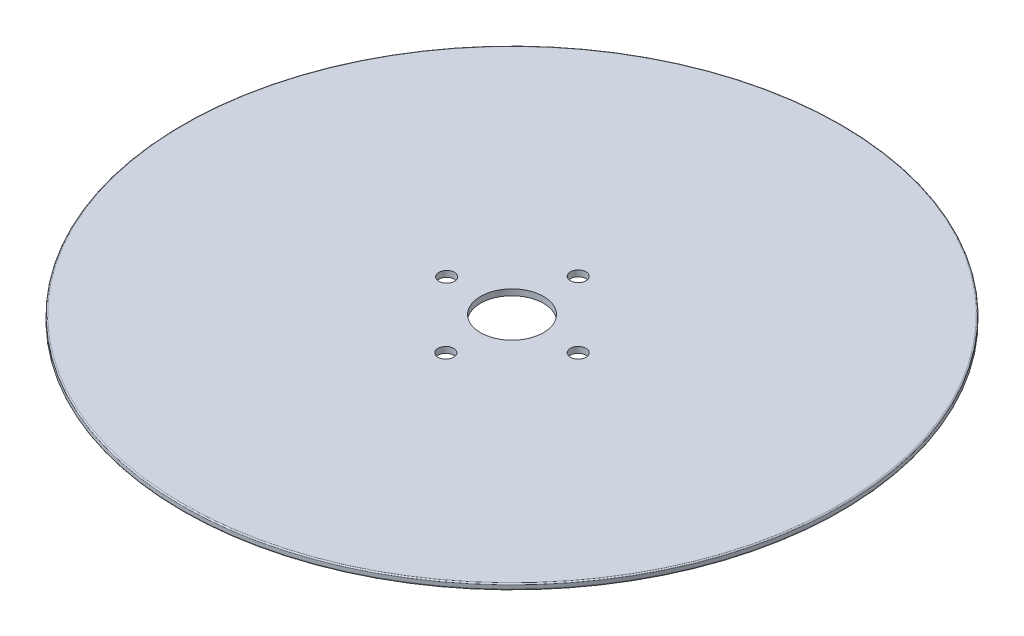
from build123d import *

# Parameters (mm, degrees)
SKETCH1_R           = 55
BOSS_EXTRUDE1_DEPTH = 1
FILLET2_R           = 0.2
SKETCH4_R           = 5.25
CUT_EXTRUDE2_DEPTH  = 78.78817405
SKETCH5_R           = 1.3
CUT_EXTRUDE3_DEPTH  = 1


with BuildPart() as part:
    # Sketch1 → Boss-Extrude1 (new body)
    with BuildSketch(Plane(origin=(0, 0, 0), x_dir=(1, 0, 0), z_dir=(0, 1, 0))):
        with Locations(Location((0, 0, 0), (0, 0, 270))):
            Circle(SKETCH1_R)
    extrude(amount=BOSS_EXTRUDE1_DEPTH)

    # Fillet2
    fillet2_edges = [part.edges().sort_by_distance(p)[0] for p in [
        (0, 0, -55),
        (0, 1, -55),
    ]]
    fillet(fillet2_edges, radius=FILLET2_R)

    # Sketch4 → Cut-Extrude2 (cut, through all)
    with BuildSketch(Plane(origin=(0, 1, 0), x_dir=(1, 0, 0), z_dir=(0, 1, 0))):
        with Locations(Location((0, 0, 0), (0, 0, 270))):
            Circle(SKETCH4_R)
    extrude(amount=-CUT_EXTRUDE2_DEPTH, mode=Mode.SUBTRACT)

    # Sketch5 → Cut-Extrude3 (cut)
    with BuildSketch(Plane(origin=(0, 1, 0), x_dir=(1, 0, 0), z_dir=(0, 1, 0))):
        with Locations(Location((-10.900916731, 0, 0), (0, 0, 270))):
            Circle(SKETCH5_R)
        with Locations(Location((0, 11.05, 0), (0, 0, 270))):
            Circle(SKETCH5_R)
        with Locations(Location((11.05, 0, 0), (0, 0, 270))):
            Circle(SKETCH5_R)
        with Locations(Location((0, -11.05, 0), (0, 0, 270))):
            Circle(SKETCH5_R)
    extrude(amount=-CUT_EXTRUDE3_DEPTH, mode=Mode.SUBTRACT)


solid = part.part
